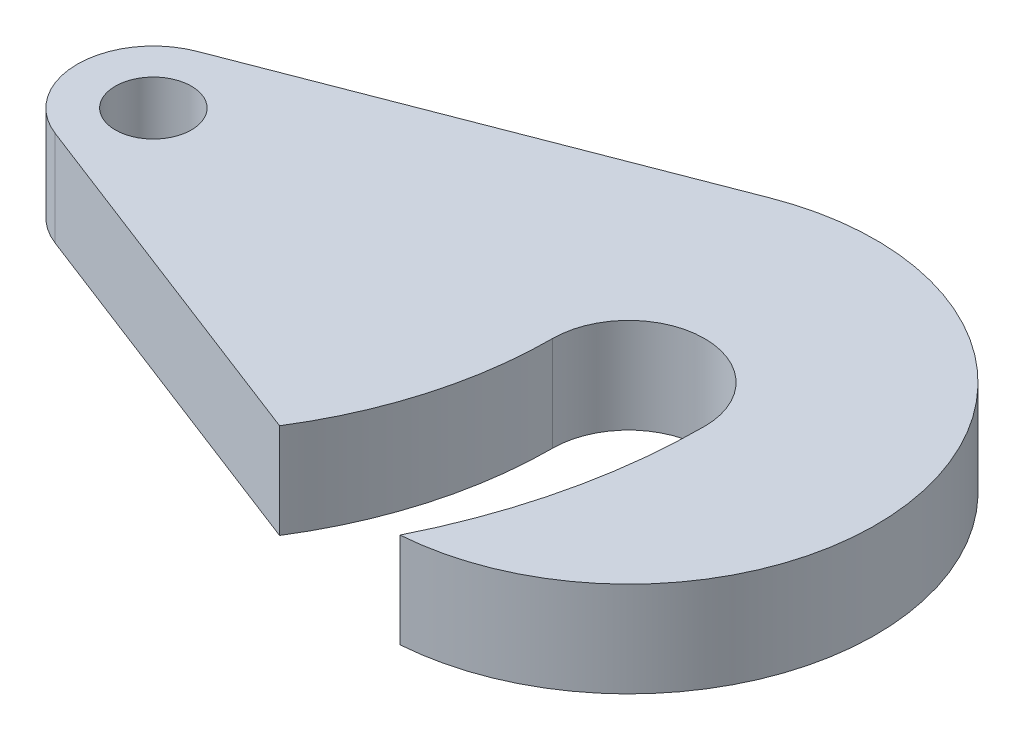
from build123d import *

# Parameters (mm, degrees)
SKETCH1_R           = 4
BOSS_EXTRUDE1_DEPTH = 10


with BuildPart() as part:
    # Sketch1 → Boss-Extrude1 (new body)
    with BuildSketch(Plane(origin=(0, 0, 0), x_dir=(1, 0, 0), z_dir=(0, 1, 0))):
        with BuildLine():
            Line((-2.88, 7.463618425), (40.64, 24.256759883))
            ThreePointArc((40.64, 24.256759883), (75.371520283, 5.682073435), (51.88, -25.931941694))
            ThreePointArc((51.88, -25.931941694), (56.44926926, -13.322161987), (58, 0))
            ThreePointArc((58, 0), (50, 8), (42, 0))
            ThreePointArc((42, 0), (40.364821154, -11.60522353), (35.586608897, -22.306798678))
            Line((35.586608897, -22.306798678), (-2.88, -7.463618425))
            ThreePointArc((-2.88, -7.463618425), (-8, 0), (-2.88, 7.463618425))
        make_face()
        with Locations(Location((0, 0, 0), (0, 0, 270))):
            Circle(SKETCH1_R, mode=Mode.SUBTRACT)
    extrude(amount=BOSS_EXTRUDE1_DEPTH)


solid = part.part
